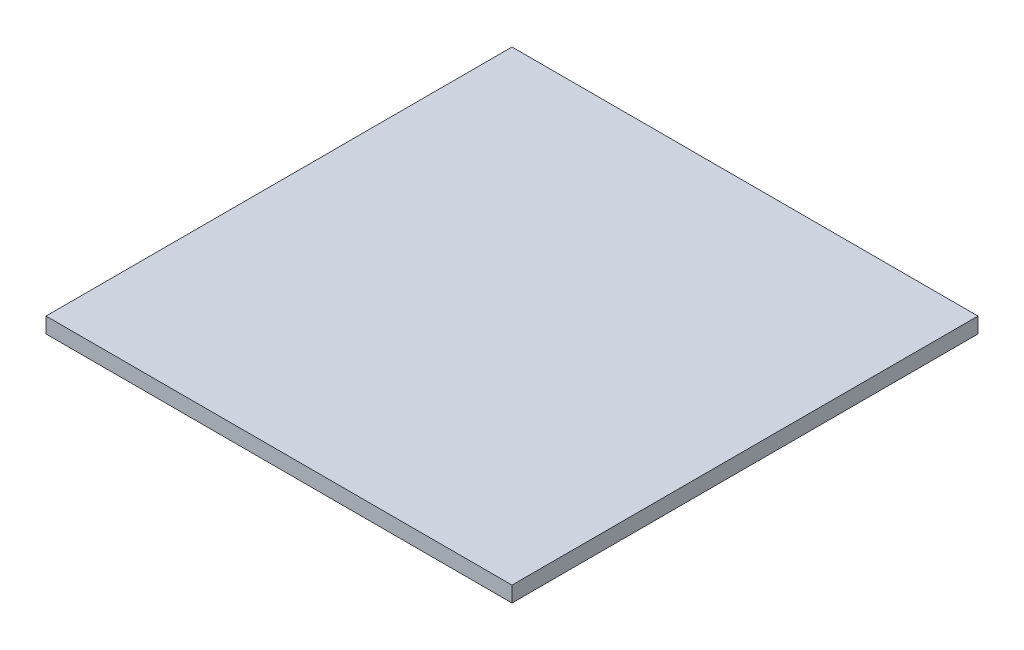
from build123d import *

# Parameters (mm, degrees)
ESBO_O1_W                = 150
ESBO_O1_H                = 150
RESSALTO_EXTRUS_O1_DEPTH = 5
ESBO_O2_R                = 5
RESSALTO_EXTRUS_O2_DEPTH = 15
ESBO_O4_R                = 1.5
CORTE_EXTRUS_O1_DEPTH    = 15


with BuildPart() as part:
    # Esboço1 → Ressalto-extrusão1 (new body)
    with BuildSketch(Plane(origin=(0, 0, 0), x_dir=(1, 0, 0), z_dir=(0, 1, 0))):
        with Locations((-258.939300439, 168.363905829)):
            Rectangle(ESBO_O1_W, ESBO_O1_H)
    extrude(amount=RESSALTO_EXTRUS_O1_DEPTH)

    # Esboço2 → Ressalto-extrusão2 (add)
    with BuildSketch(Plane(origin=(0, 0, 0), x_dir=(-1, 0, 0), z_dir=(0, -1, 0))):
        with Locations(Location((291.439300439, 135.863905829, 0), (0, 0, 270))):
            Circle(ESBO_O2_R)
        with Locations(Location((226.439300439, 135.863905829, 0), (0, 0, 270))):
            Circle(ESBO_O2_R)
        with Locations(Location((291.439300439, 200.863905829, 0), (0, 0, 270))):
            Circle(ESBO_O2_R)
        with Locations(Location((226.439300439, 200.863905829, 0), (0, 0, 270))):
            Circle(ESBO_O2_R)
    extrude(amount=RESSALTO_EXTRUS_O2_DEPTH)

    # Esboço4 → Corte-extrusão1 (cut)
    with BuildSketch(Plane(origin=(0, -15, 0), x_dir=(-1, 0, 0), z_dir=(0, -1, 0))):
        with Locations(Location((291.439300439, 135.863905829, 0), (0, 0, 90))):
            Circle(ESBO_O4_R)
        with Locations(Location((226.439300439, 135.863905829, 0), (0, 0, 90))):
            Circle(ESBO_O4_R)
        with Locations(Location((291.439300439, 200.863905829, 0), (0, 0, 90))):
            Circle(ESBO_O4_R)
        with Locations(Location((226.439300439, 200.863905829, 0), (0, 0, 90))):
            Circle(ESBO_O4_R)
    extrude(amount=-CORTE_EXTRUS_O1_DEPTH, mode=Mode.SUBTRACT)


solid = part.part
